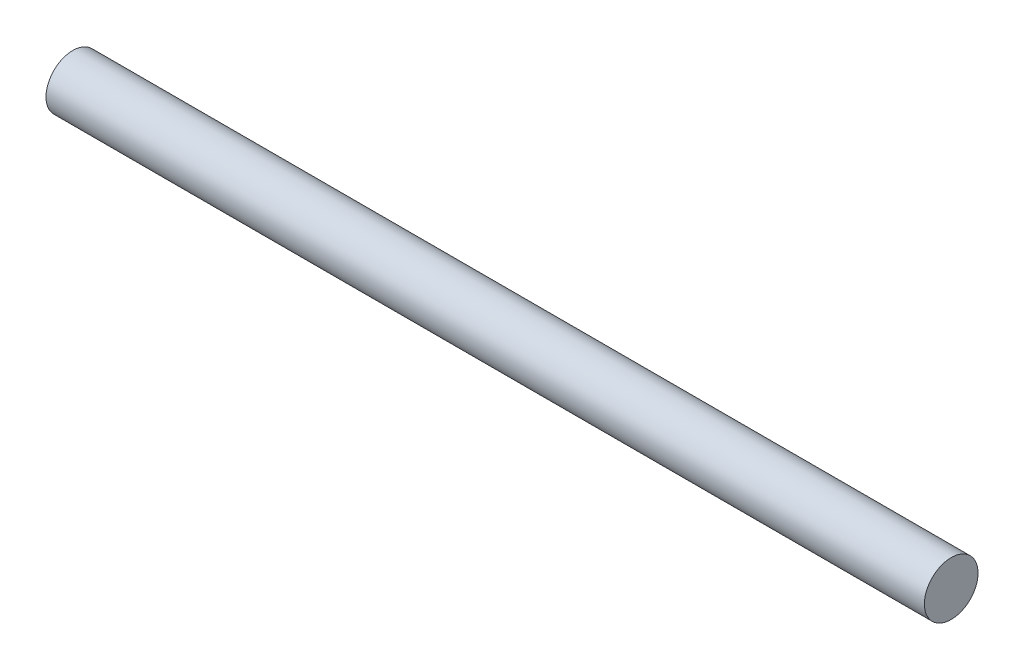
from build123d import *

# Parameters (mm, degrees)
SKIZZE1_R                       = 11
AUFSATZ_LINEAR_AUSTRAGEN1_DEPTH = 360


with BuildPart() as part:
    # Skizze1 → Aufsatz-Linear austragen1 (new body)
    with BuildSketch(Plane(origin=(0, 0, 0), x_dir=(0, 0, -1), z_dir=(1, 0, 0))):
        with Locations(Location((0, 0, 0), (0, 0, 180))):
            Circle(SKIZZE1_R)
    extrude(amount=AUFSATZ_LINEAR_AUSTRAGEN1_DEPTH)


solid = part.part
